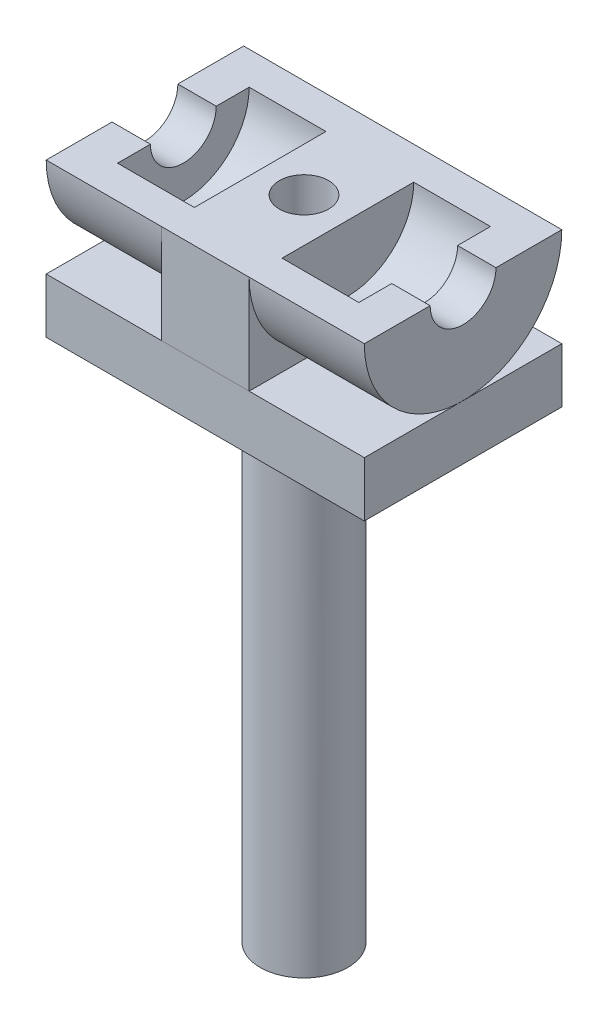
from build123d import *

# Parameters (mm, degrees)
CUT_EXTRUDE1_DEPTH      = 10
CUT_EXTRUDE1_DEPTH_BACK = 10
SKETCH4_R               = 2.25
SKETCH4_5_W             = 8
SKETCH4_5_H             = 18
SKETCH4_5_R             = 2.25
BOSS_EXTRUDE1_DEPTH     = 9
CUT_EXTRUDE2_DEPTH      = 32.670175393
CUT_EXTRUDE2_DEPTH_BACK = 32.670175393
SKETCH6_R               = 4
SKETCH6_R_2             = 2.6
BOSS_EXTRUDE2_DEPTH     = 50
BOSS_EXTRUDE4_START     = -9
SKETCH7_W               = 29
SKETCH7_H               = 18
SKETCH7_R               = 3.5
BOSS_EXTRUDE4_DEPTH     = 5


with BuildPart() as part:
    # Sketch1 → Revolve1 (revolve)
    with BuildSketch(Plane.XY, mode=Mode.PRIVATE) as revolve1_sk:
        Polygon((-14.5, 9), (14.5, 9), (14.5, 3), (11, 3), (11, 6), (-11, 6), (-11, 3), (-14.5, 3), align=None)
    revolve(revolve1_sk.sketch.rotate(Axis((-39.087837838, 0, 0), (1, 0, 0)), 90), axis=Axis((-39.087837838, 0, 0), (1, 0, 0)))

    # Sketch4 → Cut-Extrude1 (cut, two sides: drawn at the far end of the back side and taken through both)
    with BuildSketch(Plane(origin=(0, 0, 0), x_dir=(1, 0, 0), z_dir=(0, 1, 0)).offset(-CUT_EXTRUDE1_DEPTH_BACK)):
        with Locations(Location((0, 0, 0), (0, 0, 90))):
            Circle(SKETCH4_R)
    extrude(amount=CUT_EXTRUDE1_DEPTH + CUT_EXTRUDE1_DEPTH_BACK, mode=Mode.SUBTRACT)

    # Sketch4<5> → Boss-Extrude1 (add, through all)
    with BuildSketch(Plane(origin=(0, 0, 0), x_dir=(1, 0, 0), z_dir=(0, 1, 0))):
        Rectangle(SKETCH4_5_W, SKETCH4_5_H)
        with Locations(Location((0, 0, 0), (0, 0, 90))):
            Circle(SKETCH4_5_R, mode=Mode.SUBTRACT)
    extrude(amount=-BOSS_EXTRUDE1_DEPTH)

    # Sketch5 → Cut-Extrude2 (cut, two sides: drawn at the far end of the back side and taken through both)
    with BuildSketch(Plane.ZY.offset(14.5).offset(-CUT_EXTRUDE2_DEPTH_BACK)):
        Polygon((-61.985560785, 0), (-9.284472497, 0), (10.360933076, 0), (63.062021365, 0), (63.062021365, 105.402176578), (-61.985560785, 105.402176578), align=None)
    extrude(amount=CUT_EXTRUDE2_DEPTH + CUT_EXTRUDE2_DEPTH_BACK, mode=Mode.SUBTRACT)

    # Sketch6 → Boss-Extrude2 (add)
    with BuildSketch(Plane.XZ.offset(9)):
        with Locations(Location((0, 0, 0), (0, 0, 180))):
            Circle(SKETCH6_R)
        with Locations(Location((0, 0, 0), (0, 0, 270))):
            Circle(SKETCH6_R_2, mode=Mode.SUBTRACT)
    extrude(amount=BOSS_EXTRUDE2_DEPTH)


with BuildPart() as body_2:
    # Sketch7 → Boss-Extrude4 (new body)
    with BuildSketch(Plane(origin=(0, 0, 0), x_dir=(1, 0, 0), z_dir=(0, 1, 0)).offset(BOSS_EXTRUDE4_START)):
        Rectangle(SKETCH7_W, SKETCH7_H)
        with Locations(Location((0, 0, 0), (0, 0, 270))):
            Circle(SKETCH7_R, mode=Mode.SUBTRACT)
    extrude(amount=-BOSS_EXTRUDE4_DEPTH)


solid = Compound([part.part, body_2.part])
